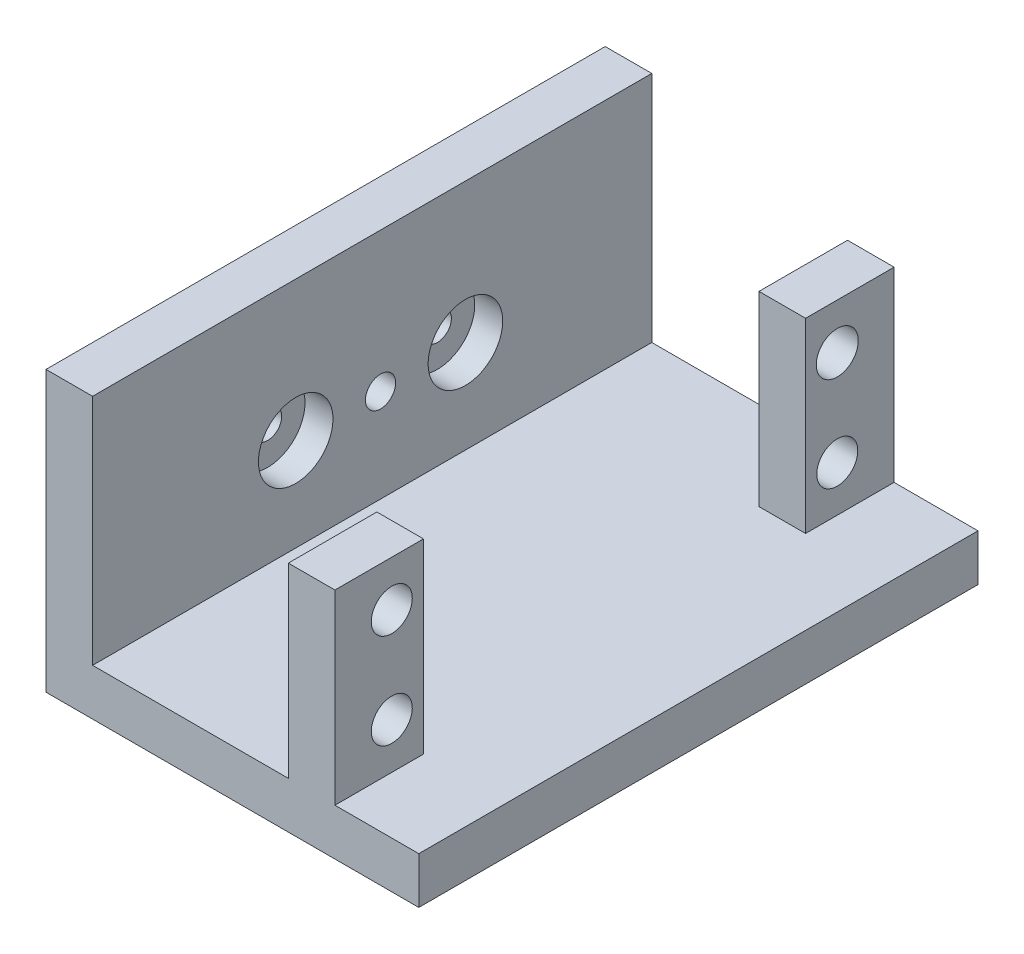
from build123d import *

# Parameters (mm, degrees)
SALIENTE_EXTRUIR1_DEPTH = 60
CROQUIS2_W              = 5
CROQUIS2_H              = 41
CORTAR_EXTRUIR1_DEPTH   = 20
CROQUIS7_R              = 2.2
CROQUIS7_R_2            = 2.253524607
CORTAR_EXTRUIR5_DEPTH   = 10
CROQUIS8_R              = 1.5
CORTAR_EXTRUIR6_DEPTH   = 10
CROQUIS9_R              = 4
CROQUIS9_R_2            = 1.621314805
CORTAR_EXTRUIR7_DEPTH   = 3
CROQUIS10_R             = 1.621314805
CORTAR_EXTRUIR8_DEPTH   = 10


with BuildPart() as part:
    # Croquis1 → Saliente-Extruir1 (new body)
    with BuildSketch(Plane.XY):
        Polygon((0, 0), (40, 0), (40, 5), (31, 5), (31, 25), (26, 25), (26, 5), (5, 5), (5, 30), (0, 30), align=None)
    extrude(amount=SALIENTE_EXTRUIR1_DEPTH)

    # Croquis2 → Cortar-Extruir1 (cut)
    with BuildSketch(Plane(origin=(0, 25, 0), x_dir=(1, 0, 0), z_dir=(0, 1, 0))):
        with Locations((28.5, -30)):
            Rectangle(CROQUIS2_W, CROQUIS2_H)
    extrude(amount=-CORTAR_EXTRUIR1_DEPTH, mode=Mode.SUBTRACT)

    # Croquis7 → Cortar-Extruir5 (cut)
    with BuildSketch(Plane(origin=(31, 0, 0), x_dir=(0, 0, -1), z_dir=(1, 0, 0))):
        with Locations(Location((-53.9, 20.1, 0), (0, 0, 90))):
            Circle(CROQUIS7_R)
        with Locations(Location((-53.9, 9.9, 0), (0, 0, 90))):
            Circle(CROQUIS7_R)
        with Locations(Location((-6.1, 9.9, 0), (0, 0, 90))):
            Circle(CROQUIS7_R)
        with Locations(Location((-6.1, 20.1, 0), (0, 0, 90))):
            Circle(CROQUIS7_R_2)
    extrude(amount=-CORTAR_EXTRUIR5_DEPTH, mode=Mode.SUBTRACT)

    # Croquis8 → Cortar-Extruir6 (cut)
    with BuildSketch(Plane.ZY):
        with Locations(Location((20, 15, 0), (0, 0, 270))):
            Circle(CROQUIS8_R)
        with Locations(Location((38.208996139, 15, 0), (0, 0, 270))):
            Circle(CROQUIS8_R)
    extrude(amount=-CORTAR_EXTRUIR6_DEPTH, mode=Mode.SUBTRACT)

    # Croquis9 → Cortar-Extruir7 (cut)
    with BuildSketch(Plane(origin=(5, 0, 0), x_dir=(0, 0, -1), z_dir=(1, 0, 0))):
        with Locations(Location((-20, 15, 0), (0, 0, 90))):
            Circle(CROQUIS9_R)
        with Locations(Location((-29.104498069, 15, 0), (0, 0, 90))):
            Circle(CROQUIS9_R_2)
        with Locations(Location((-38.208996139, 15, 0), (0, 0, 90))):
            Circle(CROQUIS9_R)
    extrude(amount=-CORTAR_EXTRUIR7_DEPTH, mode=Mode.SUBTRACT)

    # Croquis10 → Cortar-Extruir8 (cut)
    with BuildSketch(Plane(origin=(2, 0, 0), x_dir=(0, 0, -1), z_dir=(1, 0, 0))):
        with Locations(Location((-29.104498069, 15, 0), (0, 0, 90))):
            Circle(CROQUIS10_R)
    extrude(amount=-CORTAR_EXTRUIR8_DEPTH, mode=Mode.SUBTRACT)


solid = part.part
